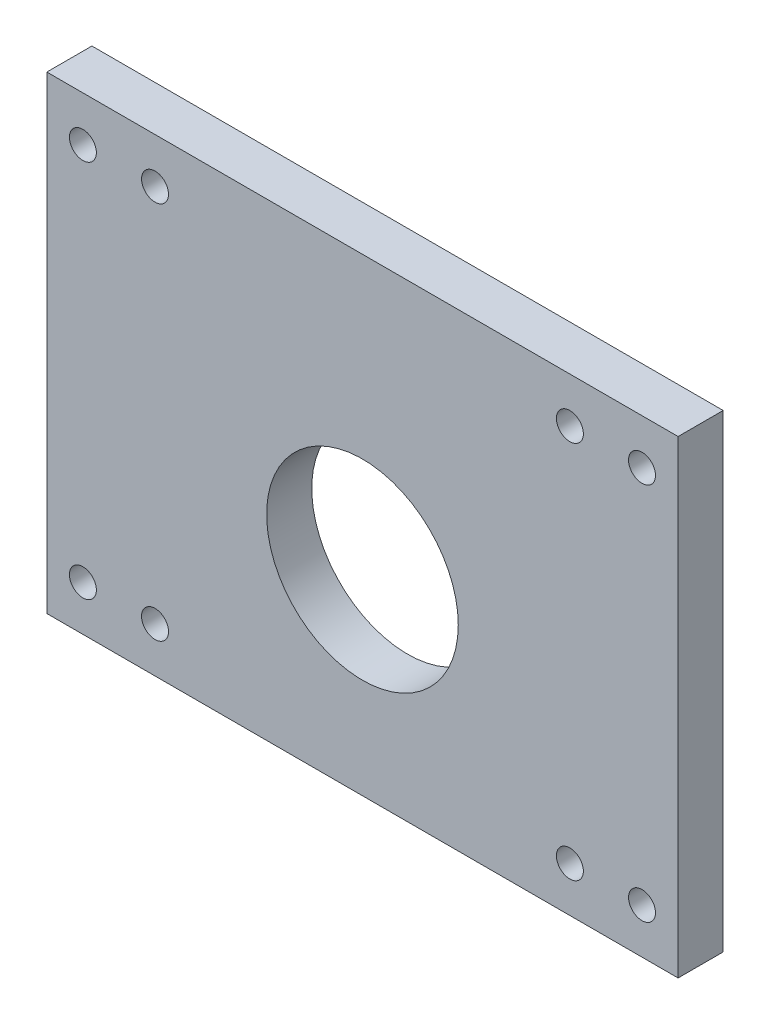
from build123d import *

# Parameters (mm, degrees)
SKETCH1_W             = 88.9
SKETCH1_H             = 66.04
SKETCH1_R             = 13.49375
BOSS_EXTRUDE1_DEPTH   = 6.35
F_6_CLEARANCE_HOLE1_D = 3.7973
F_6_CLEARANCE_HOLE2_D = 3.7973


with BuildPart() as part:
    # Sketch1 → Boss-Extrude1 (new body)
    with BuildSketch(Plane.XY):
        Rectangle(SKETCH1_W, SKETCH1_H)
        with Locations((0, -5.43814)):
            Circle(SKETCH1_R, mode=Mode.SUBTRACT)
    extrude(amount=BOSS_EXTRUDE1_DEPTH)

    # #6 Clearance Hole1 (through all)
    with Locations(Plane.XY.offset(6.35)):
        with Locations((-39.37, -26.67), (-29.21, -26.67), (29.21, -26.67), (39.37, -26.67)):
            Hole(F_6_CLEARANCE_HOLE1_D / 2)

    # #6 Clearance Hole2 (through all)
    with Locations(Plane(origin=(-39.37, 26.67, 6.35), x_dir=(1, 0, 0), z_dir=(0, 0, 1))):
        with Locations((0, 0), (10.16, 0), (68.58, 0), (78.74, 0)):
            Hole(F_6_CLEARANCE_HOLE2_D / 2)


solid = part.part
